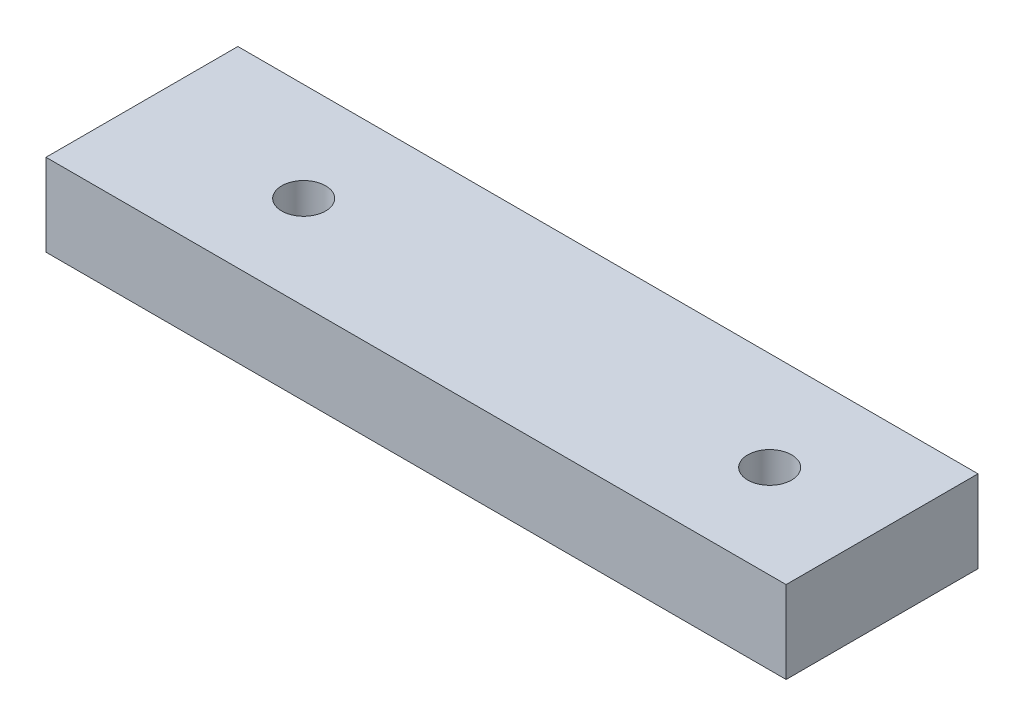
from build123d import *

# Parameters (mm, degrees)
SKETCH6_W           = 135
SKETCH6_H           = 15
BOSS_EXTRUDE1_DEPTH = 35
SKETCH7_R           = 4
CUT_EXTRUDE1_DEPTH  = 50


with BuildPart() as part:
    # Sketch6 → Boss-Extrude1 (new body)
    with BuildSketch(Plane.XY):
        with Locations((67.5, 7.5)):
            Rectangle(SKETCH6_W, SKETCH6_H)
    extrude(amount=BOSS_EXTRUDE1_DEPTH)

    # Sketch7 → Cut-Extrude1 (cut)
    with BuildSketch(Plane(origin=(0, 15, 0), x_dir=(1, 0, 0), z_dir=(0, 1, 0))):
        with Locations(Location((30, -18, 0), (0, 0, 270))):
            Circle(SKETCH7_R)
        with Locations(Location((115, -18, 0), (0, 0, 270))):
            Circle(SKETCH7_R)
    extrude(amount=-CUT_EXTRUDE1_DEPTH, mode=Mode.SUBTRACT)


solid = part.part
